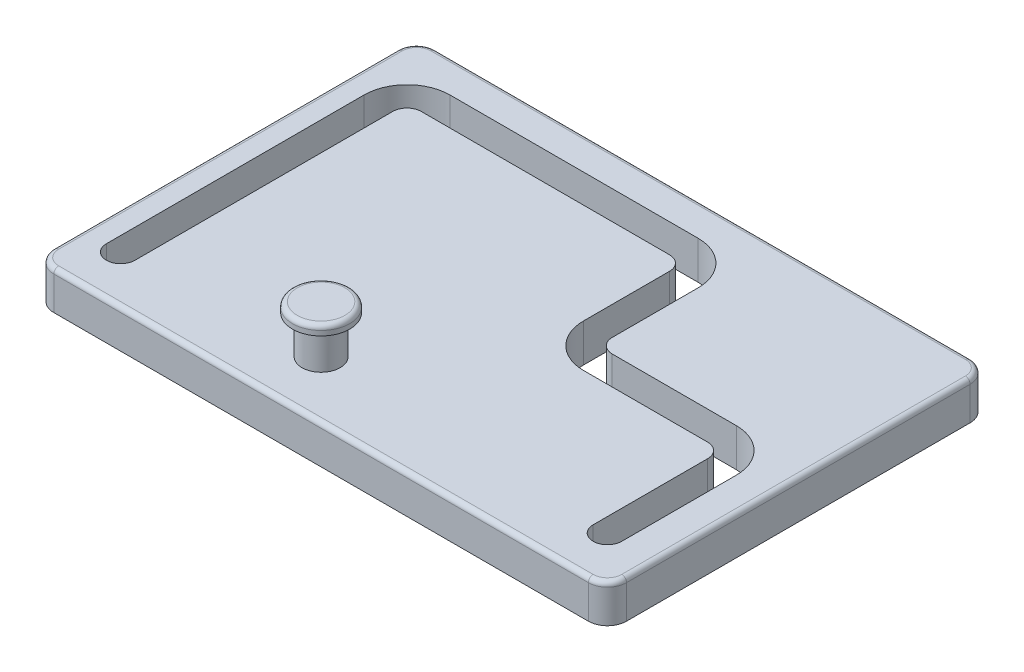
from build123d import *

# Parameters (mm, degrees)
BOSS_EXTRUDE1_DEPTH = 20
FILLET1_R           = 2.5
CUT_EXTRUDE1_REACH  = 183.384
SKETCH4_R           = 10
BOSS_EXTRUDE2_DEPTH = 20
SKETCH5_R           = 15
BOSS_EXTRUDE3_DEPTH = 5
FILLET2_R           = 2.5


with BuildPart() as part:
    # Sketch1 → Boss-Extrude1 (new body)
    with BuildSketch(Plane(origin=(0, 0, 0), x_dir=(1, 0, 0), z_dir=(0, 1, 0))):
        with BuildLine():
            Line((-140, 100), (140, 100))
            ThreePointArc((140, 100), (147.071067812, 97.071067812), (150, 90))
            Line((150, 90), (150, -90))
            ThreePointArc((150, -90), (147.071067812, -97.071067812), (140, -100))
            Line((140, -100), (-140, -100))
            ThreePointArc((-140, -100), (-147.071067812, -97.071067812), (-150, -90))
            Line((-150, -90), (-150, 90))
            ThreePointArc((-150, 90), (-147.071067812, 97.071067812), (-140, 100))
        make_face()
    extrude(amount=BOSS_EXTRUDE1_DEPTH)

    # Fillet1
    fillet1_edges = [part.edges().sort_by_distance(p)[0] for p in [
        (-147.071067812, 20, -97.071067812),
        (-150, 20, 0),
        (-147.071067812, 20, 97.071067812),
        (0, 20, 100),
        (147.071067812, 20, 97.071067812),
        (150, 20, 0),
        (147.071067812, 20, -97.071067812),
        (0, 20, -100),
    ]]
    fillet(fillet1_edges, radius=FILLET1_R)

    # Sketch3 → Cut-Extrude1 (cut, up to next)
    with BuildSketch(Plane(origin=(0, 20, 0), x_dir=(1, 0, 0), z_dir=(0, 1, 0)), mode=Mode.PRIVATE) as cut_extrude1_sk1:
        with BuildLine():
            Line((-122.5, -75), (-122.5, 60))
            ThreePointArc((-122.5, 60), (-120.303300859, 65.303300859), (-115, 67.5))
            Line((-115, 67.5), (15, 67.5))
            ThreePointArc((15, 67.5), (20.303300859, 65.303300859), (22.5, 60))
            Line((22.5, 60), (22.5, 15))
            ThreePointArc((22.5, 15), (29.090097423, -0.909902577), (45, -7.5))
            Line((45, -7.5), (110, -7.5))
            ThreePointArc((110, -7.5), (115.303300859, -9.696699141), (117.5, -15))
            Line((117.5, -15), (117.5, -75))
            ThreePointArc((117.5, -75), (125, -82.5), (132.5, -75))
            Line((132.5, -75), (132.5, -15))
            ThreePointArc((132.5, -15), (125.909902577, 0.909902577), (110, 7.5))
            Line((110, 7.5), (45, 7.5))
            ThreePointArc((45, 7.5), (39.696699141, 9.696699141), (37.5, 15))
            Line((37.5, 15), (37.5, 60))
            ThreePointArc((37.5, 60), (30.909902577, 75.909902577), (15, 82.5))
            Line((15, 82.5), (-115, 82.5))
            ThreePointArc((-115, 82.5), (-130.909902577, 75.909902577), (-137.5, 60))
            Line((-137.5, 60), (-137.5, -75))
            ThreePointArc((-137.5, -75), (-130, -82.5), (-122.5, -75))
        make_face()
    cut_extrude1_tool1 = extrude(cut_extrude1_sk1.sketch, amount=-CUT_EXTRUDE1_REACH, mode=Mode.PRIVATE) & part.part
    add(cut_extrude1_tool1.solids().sort_by_distance((-125.664253, 20, 7.5))[0], mode=Mode.SUBTRACT)

    # Sketch4 → Boss-Extrude2 (add)
    with BuildSketch(Plane(origin=(0, 20, 0), x_dir=(1, 0, 0), z_dir=(0, 1, 0))):
        with Locations(Location((-30, -70, 0), (0, 0, 90))):
            Circle(SKETCH4_R)
    extrude(amount=BOSS_EXTRUDE2_DEPTH)

    # Sketch5 → Boss-Extrude3 (add)
    with BuildSketch(Plane(origin=(0, 40, 0), x_dir=(1, 0, 0), z_dir=(0, 1, 0))):
        with Locations(Location((-30, -70, 0), (0, 0, 270))):
            Circle(SKETCH5_R)
    extrude(amount=BOSS_EXTRUDE3_DEPTH)

    # Fillet2
    fillet2_edges = [part.edges().sort_by_distance(p)[0] for p in [
        (-30, 45, 55),
    ]]
    fillet(fillet2_edges, radius=FILLET2_R)


solid = part.part
